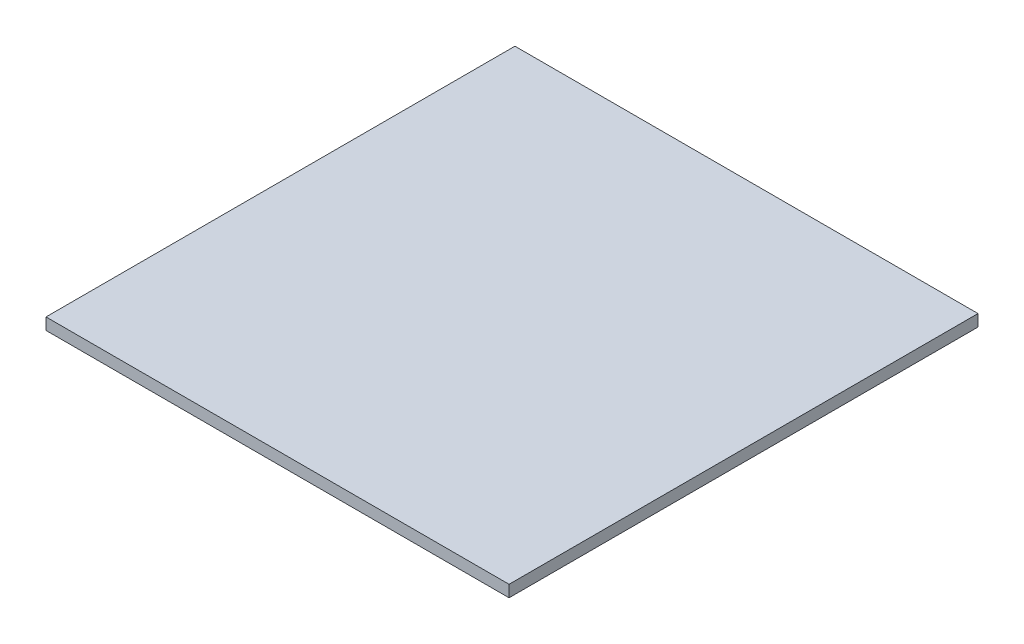
from build123d import *

# Parameters (mm, degrees)
SKETCH_1_W      = 158
SKETCH_1_H      = 160
EXTRUDE_1_DEPTH = 4


with BuildPart() as part:
    # 草图1 → 凸台-拉伸1 (new body)
    with BuildSketch(Plane(origin=(0, 0, 0), x_dir=(1, 0, 0), z_dir=(0, 1, 0))):
        Rectangle(SKETCH_1_W, SKETCH_1_H)
    extrude(amount=EXTRUDE_1_DEPTH)


solid = part.part
